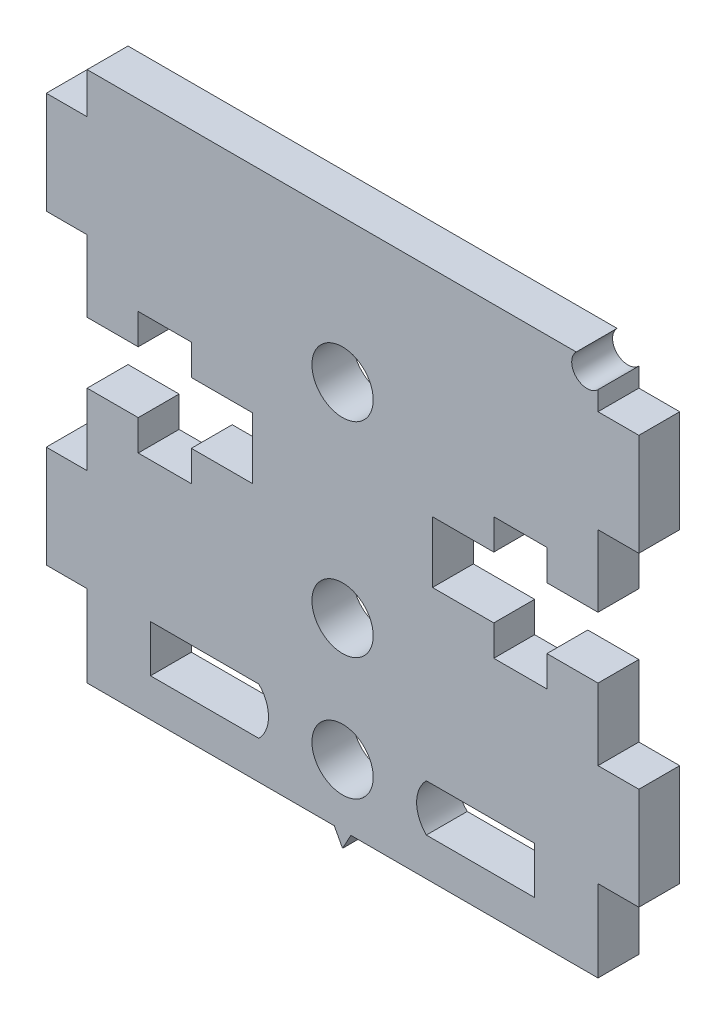
from build123d import *

# Parameters (mm, degrees)
SKETCH_1_R      = 1.5
EXTRUDE_1_DEPTH = 2


with BuildPart() as part:
    # 草图1 → 凸台-拉伸1 (new body)
    with BuildSketch(Plane.XY):
        with BuildLine():
            Line((18.317061038, 8.799028027), (16.317061038, 8.799028027))
            Line((16.317061038, 8.799028027), (16.317061038, 9.733577366))
            ThreePointArc((16.317061038, 9.733577366), (15.251610376, 9.733577366), (15.251610376, 10.799028027))
            Line((15.251610376, 10.799028027), (-8.682938962, 10.799028027))
            Line((-8.682938962, 10.799028027), (-8.682938962, 8.799028027))
            Line((-8.682938962, 8.799028027), (-10.682938962, 8.799028027))
            Line((-10.682938962, 8.799028027), (-10.682938962, 3.799028027))
            Line((-10.682938962, 3.799028027), (-8.682938962, 3.799028027))
            Line((-8.682938962, 3.799028027), (-8.682938962, 0.299028027))
            Line((-8.682938962, 0.299028027), (-6.182938962, 0.299028027))
            Line((-6.182938962, 0.299028027), (-6.182938962, 1.799028027))
            Line((-6.182938962, 1.799028027), (-3.582938962, 1.799028027))
            Line((-3.582938962, 1.799028027), (-3.582938962, 0.299028027))
            Line((-3.582938962, 0.299028027), (-0.582938962, 0.299028027))
            Line((-0.582938962, 0.299028027), (-0.582938962, -2.700971973))
            Line((-0.582938962, -2.700971973), (-3.582938962, -2.700971973))
            Line((-3.582938962, -2.700971973), (-3.582938962, -4.200971973))
            Line((-3.582938962, -4.200971973), (-6.182938962, -4.200971973))
            Line((-6.182938962, -4.200971973), (-6.182938962, -2.700971973))
            Line((-6.182938962, -2.700971973), (-8.682938962, -2.700971973))
            Line((-8.682938962, -2.700971973), (-8.682938962, -6.200971973))
            Line((-8.682938962, -6.200971973), (-10.682938962, -6.200971973))
            Line((-10.682938962, -6.200971973), (-10.682938962, -11.200971973))
            Line((-10.682938962, -11.200971973), (-8.682938962, -11.200971973))
            Line((-8.682938962, -11.200971973), (-8.682938962, -15.200971973))
            Line((-8.682938962, -15.200971973), (3.411134121, -15.200971973))
            Line((3.411134121, -15.200971973), (3.817061038, -15.955763704))
            Line((3.817061038, -15.955763704), (4.222987954, -15.200971973))
            Line((4.222987954, -15.200971973), (16.317061038, -15.200971973))
            Line((16.317061038, -15.200971973), (16.317061038, -11.200971973))
            Line((16.317061038, -11.200971973), (18.317061038, -11.200971973))
            Line((18.317061038, -11.200971973), (18.317061038, -6.200971973))
            Line((18.317061038, -6.200971973), (16.317061038, -6.200971973))
            Line((16.317061038, -6.200971973), (16.317061038, -2.700971973))
            Line((16.317061038, -2.700971973), (13.817061038, -2.700971973))
            Line((13.817061038, -2.700971973), (13.817061038, -4.200971973))
            Line((13.817061038, -4.200971973), (11.217061038, -4.200971973))
            Line((11.217061038, -4.200971973), (11.217061038, -2.700971973))
            Line((11.217061038, -2.700971973), (8.217061038, -2.700971973))
            Line((8.217061038, -2.700971973), (8.217061038, 0.299028027))
            Line((8.217061038, 0.299028027), (11.217061038, 0.299028027))
            Line((11.217061038, 0.299028027), (11.217061038, 1.799028027))
            Line((11.217061038, 1.799028027), (13.817061038, 1.799028027))
            Line((13.817061038, 1.799028027), (13.817061038, 0.299028027))
            Line((13.817061038, 0.299028027), (16.317061038, 0.299028027))
            Line((16.317061038, 0.299028027), (16.317061038, 3.799028027))
            Line((16.317061038, 3.799028027), (18.317061038, 3.799028027))
            Line((18.317061038, 3.799028027), (18.317061038, 8.799028027))
        make_face()
        with Locations((3.817061038, -6.200971973)):
            Circle(SKETCH_1_R, mode=Mode.SUBTRACT)
        with Locations((3.817061038, 3.799028027)):
            Circle(SKETCH_1_R, mode=Mode.SUBTRACT)
        with Locations((3.817061038, -12.192801434)):
            Circle(SKETCH_1_R, mode=Mode.SUBTRACT)
        with BuildLine():
            Line((13.217061038, -13.342801434), (7.917061038, -13.342801434))
            ThreePointArc((7.917061038, -13.342801434), (7.440715441, -12.192801434), (7.917061038, -11.042801434))
            Line((7.917061038, -11.042801434), (13.217061038, -11.042801434))
            Line((13.217061038, -11.042801434), (13.217061038, -13.342801434))
        make_face(mode=Mode.SUBTRACT)
        with BuildLine():
            Line((-5.582938962, -11.042801434), (-0.282938962, -11.042801434))
            ThreePointArc((-0.282938962, -11.042801434), (0.193406634, -12.192801434), (-0.282938962, -13.342801434))
            Line((-0.282938962, -13.342801434), (-5.582938962, -13.342801434))
            Line((-5.582938962, -13.342801434), (-5.582938962, -11.042801434))
        make_face(mode=Mode.SUBTRACT)
    extrude(amount=EXTRUDE_1_DEPTH)


solid = part.part
